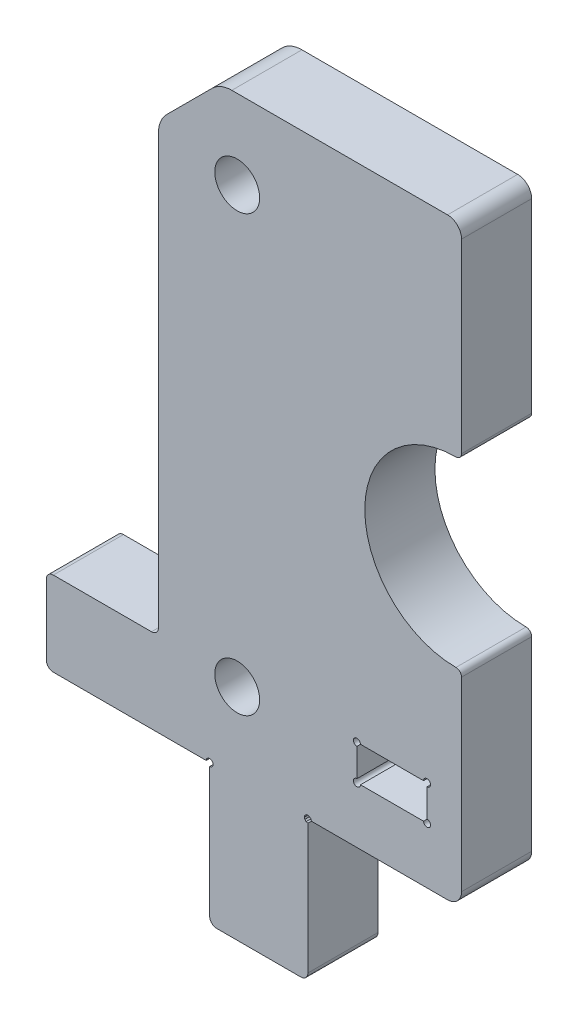
from build123d import *

# Parameters (mm, degrees)
ESQUISSE1_R        = 1.6
BOSS_EXTRU_1_DEPTH = 5
CONG_1_R           = 1


with BuildPart() as part:
    # Esquisse1 → Boss.-Extru.1 (new body)
    with BuildSketch(Plane(origin=(0, 0, 0), x_dir=(-1, 0, 0), z_dir=(0, 0, -1))):
        with BuildLine():
            Line((-29.61, 24.250000923), (-29.61, 10))
            Line((-29.61, 10), (-18.900000032, 10))
            Line((-18.900000032, 10), (-18.866500027, 10.125000016))
            Line((-18.866500027, 10.125000016), (-18.775000016, 10.216510027))
            Line((-18.775000016, 10.216510027), (-18.65, 10.250000032))
            Line((-18.65, 10.250000032), (-18.524999984, 10.216510027))
            Line((-18.524999984, 10.216510027), (-18.433489973, 10.125000016))
            Line((-18.433489973, 10.125000016), (-18.399999968, 10))
            Line((-18.399999968, 10), (-18.433489973, 9.874995396))
            Line((-18.433489973, 9.874995396), (-18.524999984, 9.783488385))
            Line((-18.524999984, 9.783488385), (-18.65, 9.74999538))
            Line((-18.65, 9.74999538), (-18.65, 0.499994211))
            ThreePointArc((-18.65, 0.499994211), (-18.503553372, 0.146440776), (-18.149999937, -5.852e-06))
            Line((-18.149999937, -5.852e-06), (-12.150000163, -5.852e-06))
            ThreePointArc((-12.150000163, -5.852e-06), (-11.796446657, 0.146440805), (-11.65, 0.499994311))
            Line((-11.65, 0.499994311), (-11.65, 9.74999538))
            Line((-11.65, 9.74999538), (-11.775000016, 9.783488385))
            Line((-11.775000016, 9.783488385), (-11.866510027, 9.874995396))
            Line((-11.866510027, 9.874995396), (-11.900000032, 9.999995412))
            Line((-11.900000032, 9.999995412), (-11.866510027, 10.124995428))
            Line((-11.866510027, 10.124995428), (-11.775000016, 10.216505439))
            Line((-11.775000016, 10.216505439), (-11.65, 10.249995444))
            Line((-11.65, 10.249995444), (-11.524999984, 10.216505439))
            Line((-11.524999984, 10.216505439), (-11.433489973, 10.124995428))
            Line((-11.433489973, 10.124995428), (-11.399999968, 9.999995412))
            Line((-11.399999968, 9.999995412), (-0.499947825, 9.999995412))
            ThreePointArc((-0.499947825, 9.999995412), (-0.14639439, 10.14644204), (5.2238e-05, 10.499995475))
            Line((5.2238e-05, 10.499995475), (5.2238e-05, 15.499995349))
            ThreePointArc((5.2238e-05, 15.499995349), (-0.14639439, 15.853548784), (-0.499947825, 15.999995412))
            Line((-0.499947825, 15.999995412), (-7.49994871, 15.999995412))
            ThreePointArc((-7.49994871, 15.999995412), (-7.853502145, 16.14644204), (-7.999948773, 16.499995475))
            Line((-7.999948773, 16.499995475), (-7.999948773, 47.071569339))
            ThreePointArc((-7.999948773, 47.071569339), (-8.152190984, 47.836942158), (-8.585740096, 48.485793767))
            Line((-8.585740096, 48.485793767), (-11.814159255, 51.714209926))
            ThreePointArc((-11.814159255, 51.714209926), (-12.46301048, 52.147758127), (-13.228382526, 52.3))
            Line((-13.228382526, 52.3), (-29.61, 52.3))
            Line((-29.61, 52.3), (-29.61, 38.049999077))
            ThreePointArc((-29.61, 38.049999077), (-29.492842932, 37.767156996), (-29.210000822, 37.65))
            ThreePointArc((-29.210000822, 37.65), (-22.71, 31.15), (-29.210000822, 24.65))
            ThreePointArc((-29.210000822, 24.65), (-29.492842932, 24.532843004), (-29.61, 24.250000923))
        make_face()
        with Locations((-13.61, 46.65)):
            Circle(ESQUISSE1_R, mode=Mode.SUBTRACT)
        with Locations((-13.61, 15.65)):
            Circle(ESQUISSE1_R, mode=Mode.SUBTRACT)
        with BuildLine():
            Line((-22.400002831, 14.000001769), (-26.900003431, 14.000001769))
            ThreePointArc((-26.900003431, 14.000001769), (-27.326780127, 13.823225074), (-27.150003431, 14.250001769))
            Line((-27.150003431, 14.250001769), (-27.150003431, 16.250002022))
            ThreePointArc((-27.150003431, 16.250002022), (-27.326780127, 16.676778718), (-26.900003431, 16.500002022))
            Line((-26.900003431, 16.500002022), (-22.400002831, 16.500002022))
            ThreePointArc((-22.400002831, 16.500002022), (-21.973226158, 16.676778803), (-22.150002831, 16.250002085))
            Line((-22.150002831, 16.250002085), (-22.150002831, 14.250001769))
            ThreePointArc((-22.150002831, 14.250001769), (-21.973226136, 13.823225074), (-22.400002831, 14.000001769))
        make_face(mode=Mode.SUBTRACT)
    extrude(amount=-BOSS_EXTRU_1_DEPTH)

    # Congé1
    cong_1_edges = [part.edges().sort_by_distance(p)[0] for p in [
        (29.61, 10, 2.5),
        (29.61, 52.3, 2.5),
    ]]
    fillet(cong_1_edges, radius=CONG_1_R)


solid = part.part
